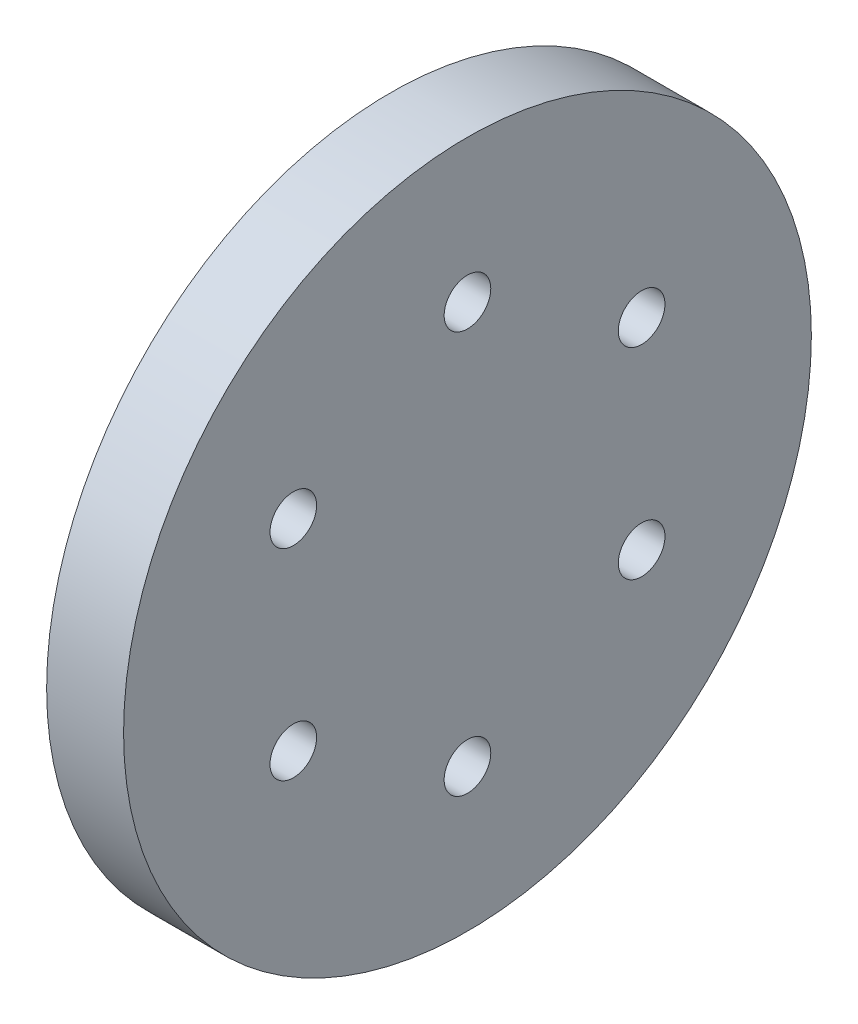
from build123d import *

# Parameters (mm, degrees)
SKETCH_1_R          = 29.5
EXTRUDE_1_DEPTH     = 6.6
SKETCH_2_R          = 2
CUT_EXTRUDE_1_DEPTH = 21


with BuildPart() as part:
    # 草图1 → 凸台-拉伸1 (new body)
    with BuildSketch(Plane(origin=(0, 0, 0), x_dir=(0, 0, -1), z_dir=(1, 0, 0))):
        Circle(SKETCH_1_R)
    extrude(amount=EXTRUDE_1_DEPTH)

    # 草图2 → 切除-拉伸1 (cut)
    with BuildSketch(Plane(origin=(6.6, 0, 0), x_dir=(0, 0, -1), z_dir=(1, 0, 0))):
        with Locations((0, 17.25)):
            Circle(SKETCH_2_R)
        with Locations((14.938938215, 8.625)):
            Circle(SKETCH_2_R)
        with Locations((14.938938215, -8.625)):
            Circle(SKETCH_2_R)
        with Locations((0, -17.25)):
            Circle(SKETCH_2_R)
        with Locations((-14.938938215, -8.625)):
            Circle(SKETCH_2_R)
        with Locations((-14.938938215, 8.625)):
            Circle(SKETCH_2_R)
    extrude(amount=-CUT_EXTRUDE_1_DEPTH, mode=Mode.SUBTRACT)


solid = part.part
